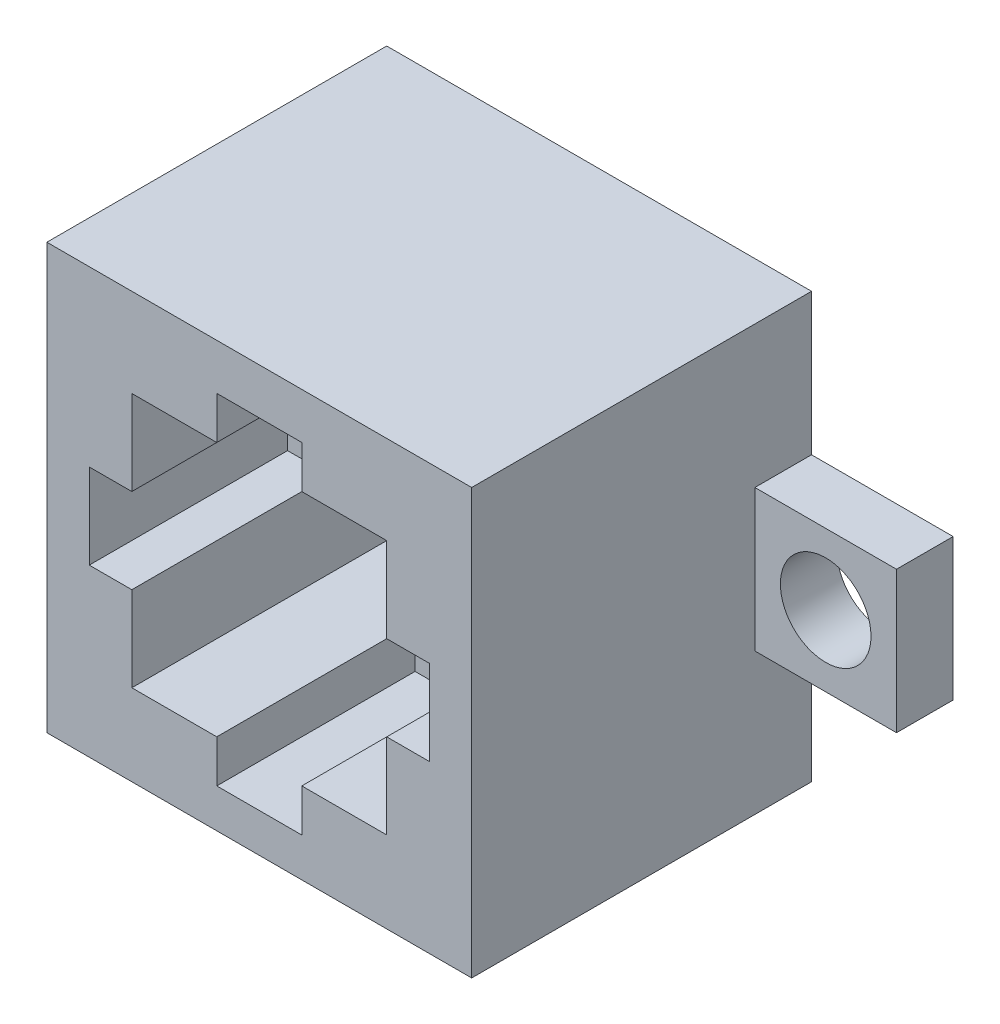
from build123d import *

# Parameters (mm, degrees)
SKETCH1_W           = 15.000000596
SKETCH1_H           = 15.000000597
BOSS_EXTRUDE1_DEPTH = 12.000000104
SKETCH2_W           = 8.999999613
SKETCH2_H           = 9.000003338
CUT_EXTRUDE1_DEPTH  = 11.002000072
SKETCH3_W           = 6.504997611
SKETCH3_H           = 6.504997611
CUT_EXTRUDE2_DEPTH  = 102.11874099
SKETCH4_W           = 3.00199911
SKETCH4_H           = 7.001999765
CUT_EXTRUDE3_DEPTH  = 1.501999795
SKETCH5_W           = 7.001999765
SKETCH5_H           = 3.002002835
CUT_EXTRUDE4_DEPTH  = 1.501999795
SKETCH6_W           = 7.001999765
SKETCH6_H           = 3.002002835
CUT_EXTRUDE5_DEPTH  = 1.502998173
SKETCH7_W           = 3.00199911
SKETCH7_H           = 7.001999765
CUT_EXTRUDE6_DEPTH  = 1.502998173
SKETCH9_W           = 2
SKETCH9_H           = 5.000000597
BOSS_EXTRUDE2_DEPTH = 5
SKETCH10_W          = 2
SKETCH10_H          = 5.000000597
BOSS_EXTRUDE3_DEPTH = 5
SKETCH11_R          = 1.6
CUT_EXTRUDE7_DEPTH  = 5


with BuildPart() as part:
    # Sketch1 → Boss-Extrude1 (new body)
    with BuildSketch(Plane(origin=(0, 0, 0), x_dir=(-1, 0, 0), z_dir=(0, 0, -1))):
        with Locations((47.499999404, 76.49999857)):
            Rectangle(SKETCH1_W, SKETCH1_H)
    extrude(amount=-BOSS_EXTRUDE1_DEPTH)

    # Sketch2 → Cut-Extrude1 (cut)
    with BuildSketch(Plane.XY.offset(12.000000104)):
        with Locations((-47.500001266, 76.375000179)):
            Rectangle(SKETCH2_W, SKETCH2_H)
    extrude(amount=-CUT_EXTRUDE1_DEPTH, mode=Mode.SUBTRACT)

    # Sketch3 → Cut-Extrude2 (cut, through all)
    with BuildSketch(Plane(origin=(0, 0, 0), x_dir=(-1, 0, 0), z_dir=(0, 0, -1))):
        with Locations((47.500498593, 76.375499367)):
            Rectangle(SKETCH3_W, SKETCH3_H)
    extrude(amount=-CUT_EXTRUDE2_DEPTH, mode=Mode.SUBTRACT)

    # Sketch4 → Cut-Extrude3 (cut)
    with BuildSketch(Plane(origin=(0, 71.87499851, 0), x_dir=(-1, 0, 0), z_dir=(0, 1, 0))):
        with Locations((47.500001267, 8.499000222)):
            Rectangle(SKETCH4_W, SKETCH4_H)
    extrude(amount=-CUT_EXTRUDE3_DEPTH, mode=Mode.SUBTRACT)

    # Sketch5 → Cut-Extrude4 (cut)
    with BuildSketch(Plane.ZY.offset(43.00000146)):
        with Locations((8.499000222, 76.375000179)):
            Rectangle(SKETCH5_W, SKETCH5_H)
    extrude(amount=-CUT_EXTRUDE4_DEPTH, mode=Mode.SUBTRACT)

    # Sketch6 → Cut-Extrude5 (cut)
    with BuildSketch(Plane(origin=(-52.000001073, 0, 0), x_dir=(0, 0, -1), z_dir=(1, 0, 0))):
        with Locations((-8.499000222, 76.375000179)):
            Rectangle(SKETCH6_W, SKETCH6_H)
    extrude(amount=-CUT_EXTRUDE5_DEPTH, mode=Mode.SUBTRACT)

    # Sketch7 → Cut-Extrude6 (cut)
    with BuildSketch(Plane.XZ.offset(-80.875001848)):
        with Locations((-47.500001267, 8.499000222)):
            Rectangle(SKETCH7_W, SKETCH7_H)
    extrude(amount=-CUT_EXTRUDE6_DEPTH, mode=Mode.SUBTRACT)

    # Sketch9 → Boss-Extrude2 (add)
    with BuildSketch(Plane.ZY.offset(54.999999702)):
        with Locations((1, 76.49999857)):
            Rectangle(SKETCH9_W, SKETCH9_H)
    extrude(amount=BOSS_EXTRUDE2_DEPTH)

    # Sketch10 → Boss-Extrude3 (add)
    with BuildSketch(Plane(origin=(-39.999999106, 0, 0), x_dir=(0, 0, -1), z_dir=(1, 0, 0))):
        with Locations((-1, 76.49999857)):
            Rectangle(SKETCH10_W, SKETCH10_H)
    extrude(amount=BOSS_EXTRUDE3_DEPTH)

    # Sketch11 → Cut-Extrude7 (cut)
    with BuildSketch(Plane.XY.offset(2)):
        with Locations((-37.499999106, 76.499998569)):
            Circle(SKETCH11_R)
        with Locations((-57.499999702, 76.499998569)):
            Circle(SKETCH11_R)
    extrude(amount=-CUT_EXTRUDE7_DEPTH, mode=Mode.SUBTRACT)


solid = part.part
